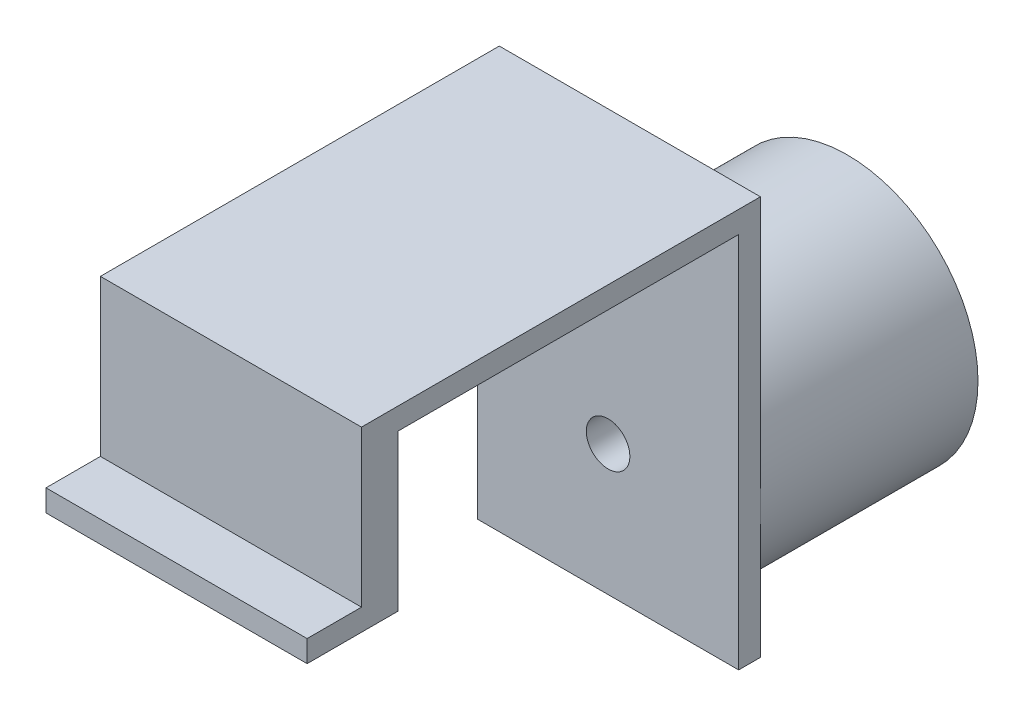
from build123d import *

# Parameters (mm, degrees)
SKETCH2_R               = 18
BOSS_EXTRUDE1_DEPTH     = 30
SKETCH4_W               = 36
SKETCH4_H               = 55
BOSS_EXTRUDE2_DEPTH     = 3
CUT_EXTRUDE1_DEPTH      = 3
CUT_EXTRUDE1_DEPTH_BACK = 60
SKETCH3_R               = 3
SKETCH6_W               = 36
SKETCH6_H               = 47
BOSS_EXTRUDE3_DEPTH     = 3
BOSS_EXTRUDE4_DEPTH     = 5
SKETCH8_W               = 36
SKETCH8_H               = 3
BOSS_EXTRUDE5_DEPTH     = 7.5


with BuildPart() as part:
    # Sketch2 → Boss-Extrude1 (new body)
    with BuildSketch(Plane.XY):
        Circle(SKETCH2_R)
    extrude(amount=BOSS_EXTRUDE1_DEPTH)

    # Sketch4 → Boss-Extrude2 (add)
    with BuildSketch(Plane.XY.offset(30)):
        with Locations((0, 9.5)):
            Rectangle(SKETCH4_W, SKETCH4_H)
    extrude(amount=BOSS_EXTRUDE2_DEPTH)

    # Sketch3 → Cut-Extrude1 (cut, two sides: drawn at the far end of the back side and taken through both)
    with BuildSketch(Plane.XY.offset(30).offset(-CUT_EXTRUDE1_DEPTH_BACK)):
        Circle(SKETCH3_R)
    extrude(amount=CUT_EXTRUDE1_DEPTH + CUT_EXTRUDE1_DEPTH_BACK, mode=Mode.SUBTRACT)

    # Sketch6 → Boss-Extrude3 (add)
    with BuildSketch(Plane(origin=(0, 37, 0), x_dir=(1, 0, 0), z_dir=(0, 1, 0))):
        with Locations((0, -56.5)):
            Rectangle(SKETCH6_W, SKETCH6_H)
    extrude(amount=-BOSS_EXTRUDE3_DEPTH)

    # Sketch7 → Boss-Extrude4 (add)
    with BuildSketch(Plane.XY.offset(80)):
        Polygon((18, 34), (18, 12.5), (-18, 12.5), (-18, 34), (-18, 37), (18, 37), align=None)
    extrude(amount=BOSS_EXTRUDE4_DEPTH)

    # Sketch8 → Boss-Extrude5 (add)
    with BuildSketch(Plane.XY.offset(85)):
        with Locations((0, 14)):
            Rectangle(SKETCH8_W, SKETCH8_H)
    extrude(amount=BOSS_EXTRUDE5_DEPTH)


solid = part.part
